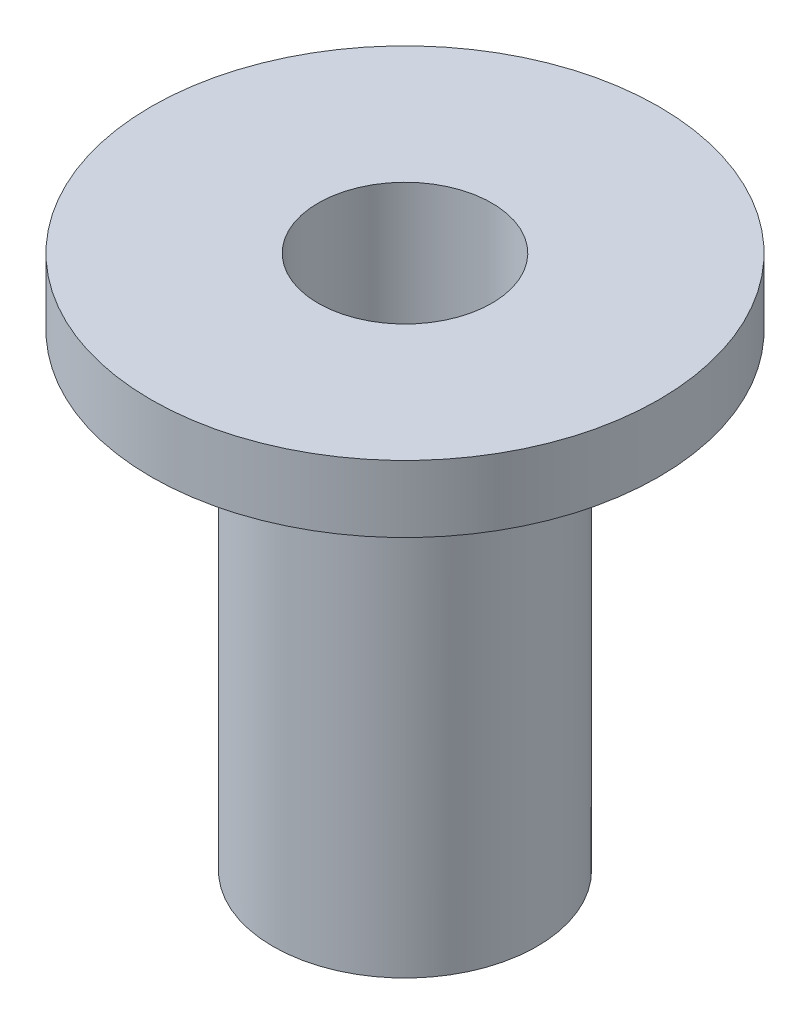
from build123d import *

# Parameters (mm, degrees)
CHAMFER1_SIZE = 0.5


with BuildPart() as part:
    # Sketch1 → Revolve1 (revolve)
    with BuildSketch(Plane.XY, mode=Mode.PRIVATE) as revolve1_sk:
        Polygon((-2.6, 0), (-2.6, 16), (-7.6, 16), (-7.6, 14), (-3.95, 14), (-3.95, 0), align=None)
    revolve(revolve1_sk.sketch.rotate(Axis((0, 5.173411558, 0), (0, -1, 0)), 270), axis=Axis((0, 5.173411558, 0), (0, -1, 0)))

    # Chamfer1
    chamfer1_edges = [part.edges().sort_by_distance(p)[0] for p in [
        (0, 14, -3.95),
    ]]
    chamfer(chamfer1_edges, length=CHAMFER1_SIZE)


solid = part.part
